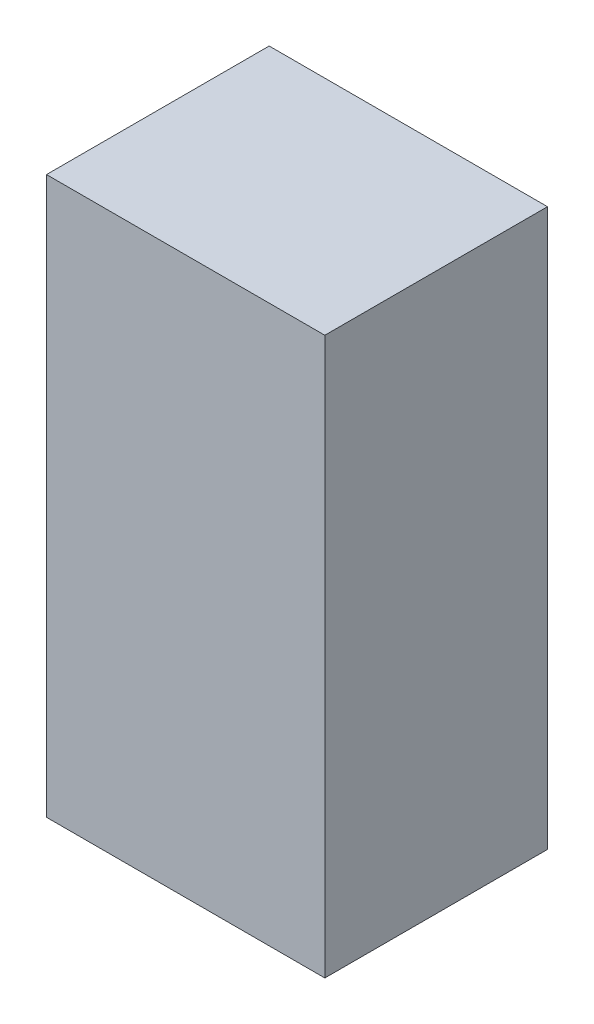
from build123d import *

# Parameters (mm, degrees)
SKETCH1_W           = 150
SKETCH1_H           = 75
BOSS_EXTRUDE1_DEPTH = 60


with BuildPart() as part:
    # Sketch1 → Boss-Extrude1 (new body)
    with BuildSketch(Plane(origin=(0, 0, 0), x_dir=(0, 1, 0), z_dir=(0, 0, 1))):
        Rectangle(SKETCH1_W, SKETCH1_H)
    extrude(amount=BOSS_EXTRUDE1_DEPTH)


solid = part.part
